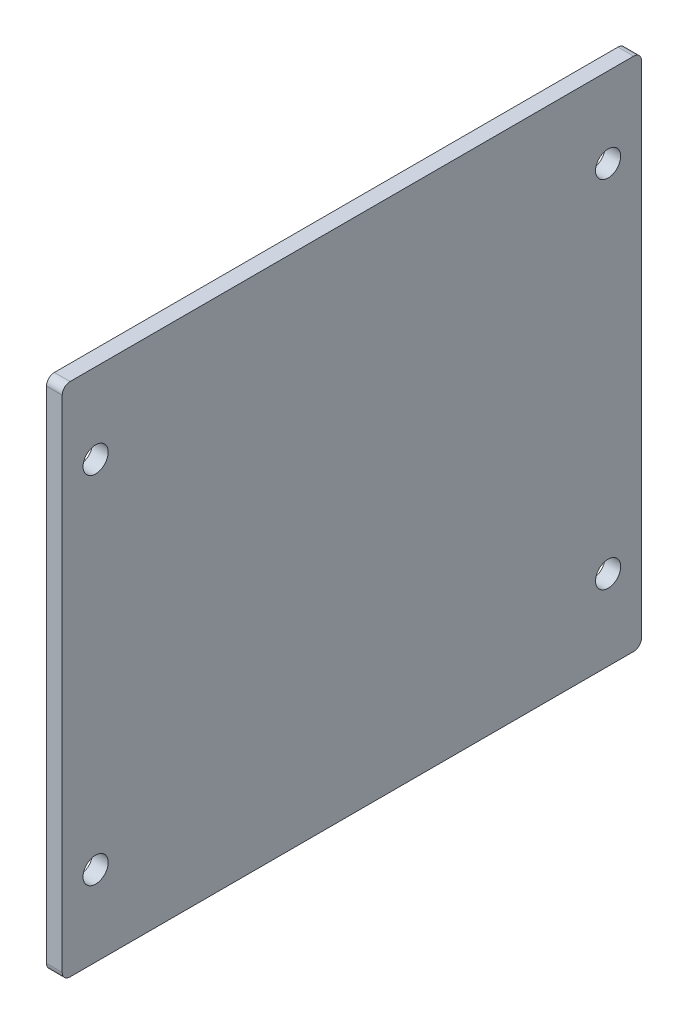
from build123d import *

# Parameters (mm, degrees)
SKETCH1_W               = 73.7
SKETCH1_H               = 65.6
BOSS_EXTRUDE1_DEPTH     = 2
FILLET1_R               = 1
CUT_EXTRUDE1_DEPTH      = 88.9202053
CUT_EXTRUDE1_DEPTH_BACK = 88.9202053
SKETCH2_R               = 1.6


with BuildPart() as part:
    # Sketch1 → Boss-Extrude1 (new body)
    with BuildSketch(Plane(origin=(0, 0, 0), x_dir=(0, 0, -1), z_dir=(1, 0, 0))):
        with Locations((0, -47)):
            Rectangle(SKETCH1_W, SKETCH1_H)
    extrude(amount=BOSS_EXTRUDE1_DEPTH)

    # Fillet1
    fillet1_edges = [part.edges().sort_by_distance(p)[0] for p in [
        (1, -14.2, 36.85),
        (1, -14.2, -36.85),
        (1, -79.8, -36.85),
        (1, -79.8, 36.85),
    ]]
    fillet(fillet1_edges, radius=FILLET1_R)

    # Sketch2 → Cut-Extrude1 (cut, two sides: drawn at the far end of the back side and taken through both)
    with BuildSketch(Plane(origin=(0, 0, 0), x_dir=(0, 0, -1), z_dir=(1, 0, 0)).offset(-CUT_EXTRUDE1_DEPTH_BACK)):
        with Locations((-32.6, -69.6)):
            Circle(SKETCH2_R)
        with Locations(Location((32.6, -69.6, 0), (0, 0, 180))):
            Circle(SKETCH2_R)
        with Locations((32.6, -24.4)):
            Circle(SKETCH2_R)
        with Locations(Location((-32.6, -24.4, 0), (0, 0, 180))):
            Circle(SKETCH2_R)
    extrude(amount=CUT_EXTRUDE1_DEPTH + CUT_EXTRUDE1_DEPTH_BACK, mode=Mode.SUBTRACT)


solid = part.part
